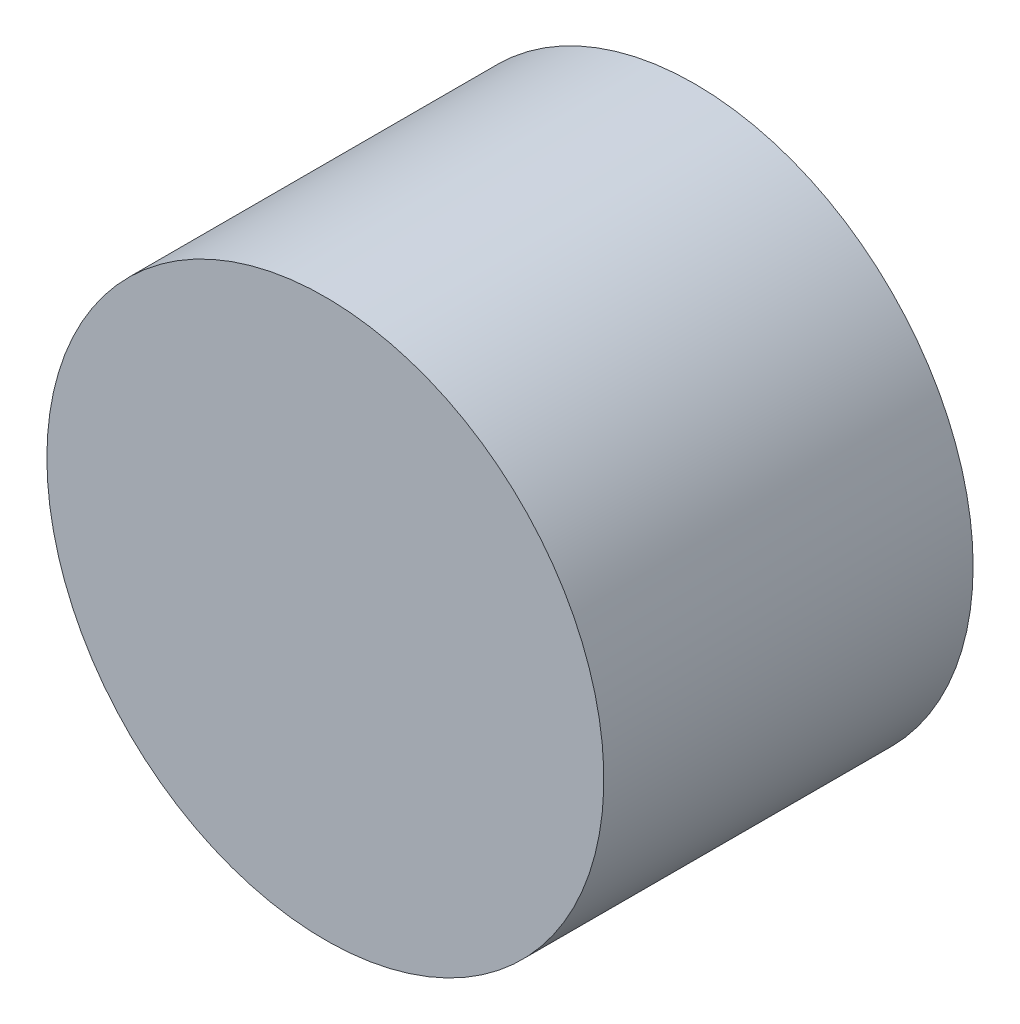
from build123d import *

# Parameters (mm, degrees)
SKETCH2_R           = 1.778
BOSS_EXTRUDE1_DEPTH = 1.651
SKETCH4_R           = 4.40562407
BOSS_EXTRUDE2_DEPTH = 5.842


with BuildPart() as part:
    # Sketch2 → Boss-Extrude1 (new body)
    with BuildSketch(Plane.XY):
        with Locations((-8.763, -27.305)):
            Circle(SKETCH2_R)
    extrude(amount=-BOSS_EXTRUDE1_DEPTH)

    # Sketch4 → Boss-Extrude2 (add)
    with BuildSketch(Plane.XY):
        with Locations(Location((-8.763, -27.305, 0), (0, 0, 180))):
            Circle(SKETCH4_R)
    extrude(amount=BOSS_EXTRUDE2_DEPTH)


solid = part.part
